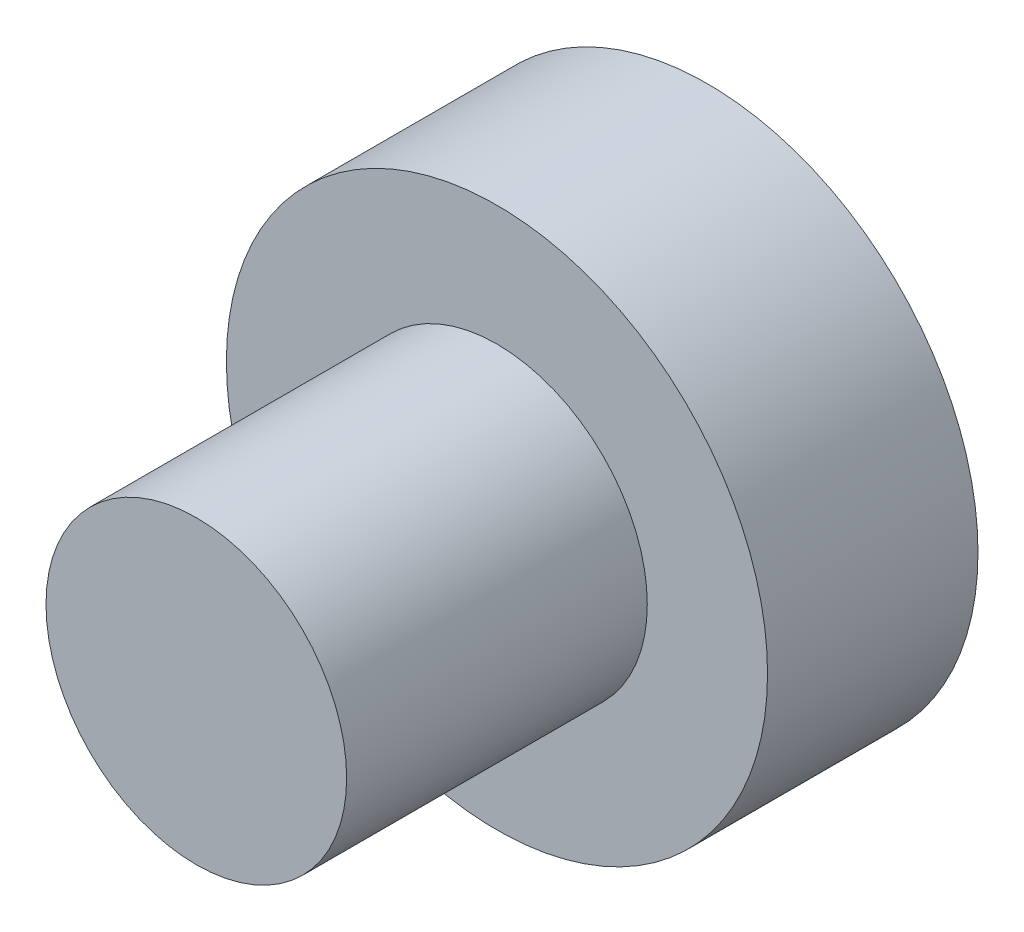
from build123d import *

# Parameters (mm, degrees)
SKETCH1_R           = 5
BOSS_EXTRUDE1_DEPTH = 10
SKETCH2_R           = 9
BOSS_EXTRUDE2_DEPTH = 7
SKETCH3_R           = 5.1
CUT_EXTRUDE1_DEPTH  = 6


with BuildPart() as part:
    # Sketch1 → Boss-Extrude1 (new body)
    with BuildSketch(Plane.XY):
        Circle(SKETCH1_R)
    extrude(amount=BOSS_EXTRUDE1_DEPTH)

    # Sketch2 → Boss-Extrude2 (add)
    with BuildSketch(Plane(origin=(0, 0, 0), x_dir=(-1, 0, 0), z_dir=(0, 0, -1))):
        Circle(SKETCH2_R)
    extrude(amount=BOSS_EXTRUDE2_DEPTH)

    # Sketch3 → Cut-Extrude1 (cut)
    with BuildSketch(Plane(origin=(0, 0, -7), x_dir=(-1, 0, 0), z_dir=(0, 0, -1))):
        Circle(SKETCH3_R)
    extrude(amount=-CUT_EXTRUDE1_DEPTH, mode=Mode.SUBTRACT)


solid = part.part
